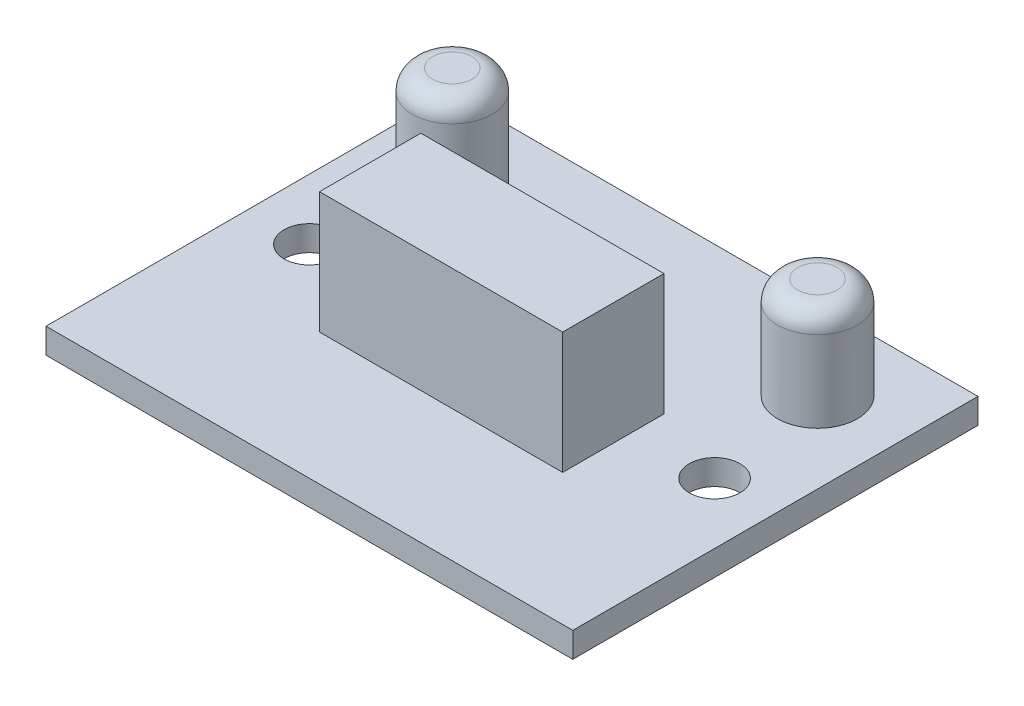
from build123d import *

# Parameters (mm, degrees)
SKETCH1_W           = 33.02
SKETCH1_H           = 25.4
SKETCH1_R           = 1.5875
BOSS_EXTRUDE1_DEPTH = 1.5748
SKETCH2_W           = 15.24
SKETCH2_H           = 6.35
BOSS_EXTRUDE2_DEPTH = 7.62
SKETCH3_R           = 2.5
BOSS_EXTRUDE3_DEPTH = 6.35
FILLET1_R           = 1.27


with BuildPart() as part:
    # Sketch1 → Boss-Extrude1 (new body)
    with BuildSketch(Plane(origin=(0, 0, 0), x_dir=(1, 0, 0), z_dir=(0, 1, 0))):
        with Locations((16.51, 12.7)):
            Rectangle(SKETCH1_W, SKETCH1_H)
        with Locations(Location((3.81, 12.7, 0), (0, 0, 270))):
            Circle(SKETCH1_R, mode=Mode.SUBTRACT)
        with Locations(Location((29.21, 12.7, 0), (0, 0, 270))):
            Circle(SKETCH1_R, mode=Mode.SUBTRACT)
    extrude(amount=BOSS_EXTRUDE1_DEPTH)

    # Sketch2 → Boss-Extrude2 (add)
    with BuildSketch(Plane(origin=(0, 1.5748, 0), x_dir=(1, 0, 0), z_dir=(0, 1, 0))):
        with Locations((16.51, 11.43)):
            Rectangle(SKETCH2_W, SKETCH2_H)
    extrude(amount=BOSS_EXTRUDE2_DEPTH)

    # Sketch3 → Boss-Extrude3 (add)
    with BuildSketch(Plane(origin=(0, 1.5748, 0), x_dir=(1, 0, 0), z_dir=(0, 1, 0))):
        with Locations(Location((5.063331186, 20.404812086, 0), (0, 0, 90))):
            Circle(SKETCH3_R)
        with Locations(Location((27.956668814, 20.404812086, 0), (0, 0, 90))):
            Circle(SKETCH3_R)
    extrude(amount=BOSS_EXTRUDE3_DEPTH)

    # Fillet1
    fillet1_edges = [part.edges().sort_by_distance(p)[0] for p in [
        (5.063331186, 7.9248, -17.904812086),
        (27.956668814, 7.9248, -17.904812086),
    ]]
    fillet(fillet1_edges, radius=FILLET1_R)


solid = part.part
